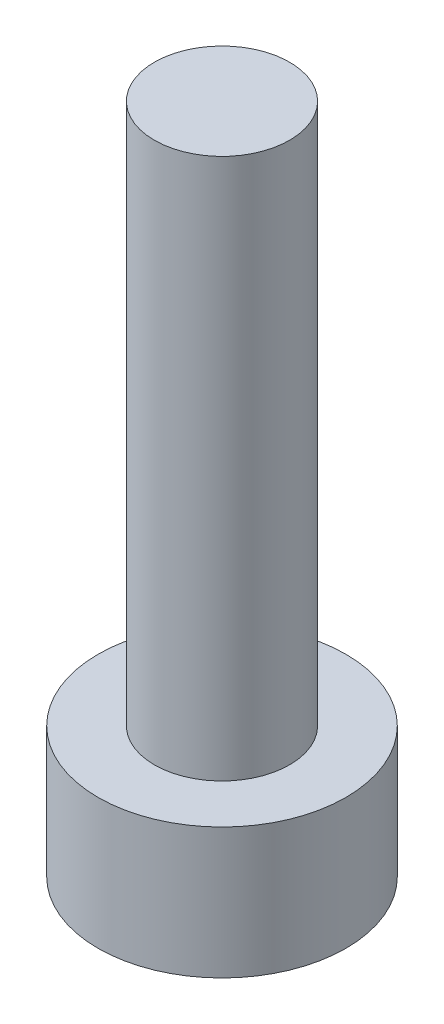
from build123d import *

# Parameters (mm, degrees)
SKETCH_1_R          = 1.5
EXTRUDE_1_DEPTH     = 12
SKETCH_2_R          = 2.75
EXTRUDE_2_DEPTH     = 2.9
CUT_EXTRUDE_1_DEPTH = 1.5


with BuildPart() as part:
    # 草图1 → 凸台-拉伸1 (new body)
    with BuildSketch(Plane(origin=(0, 0, 0), x_dir=(1, 0, 0), z_dir=(0, 1, 0))):
        with Locations(Location((0, 0, 0), (0, 0, 270))):
            Circle(SKETCH_1_R)
    extrude(amount=EXTRUDE_1_DEPTH)

    # 草图2 → 凸台-拉伸2 (add)
    with BuildSketch(Plane.XZ):
        with Locations(Location((0, 0, 0), (0, 0, 270))):
            Circle(SKETCH_2_R)
    extrude(amount=EXTRUDE_2_DEPTH)

    # 草图3 → 切除-拉伸1 (cut)
    with BuildSketch(Plane.XZ.offset(2.9)):
        Polygon((1.25, 0.721687836), (0, 1.443375673), (-1.25, 0.721687836), (-1.25, -0.721687836), (0, -1.443375673), (1.25, -0.721687836), align=None)
    extrude(amount=-CUT_EXTRUDE_1_DEPTH, mode=Mode.SUBTRACT)


solid = part.part
